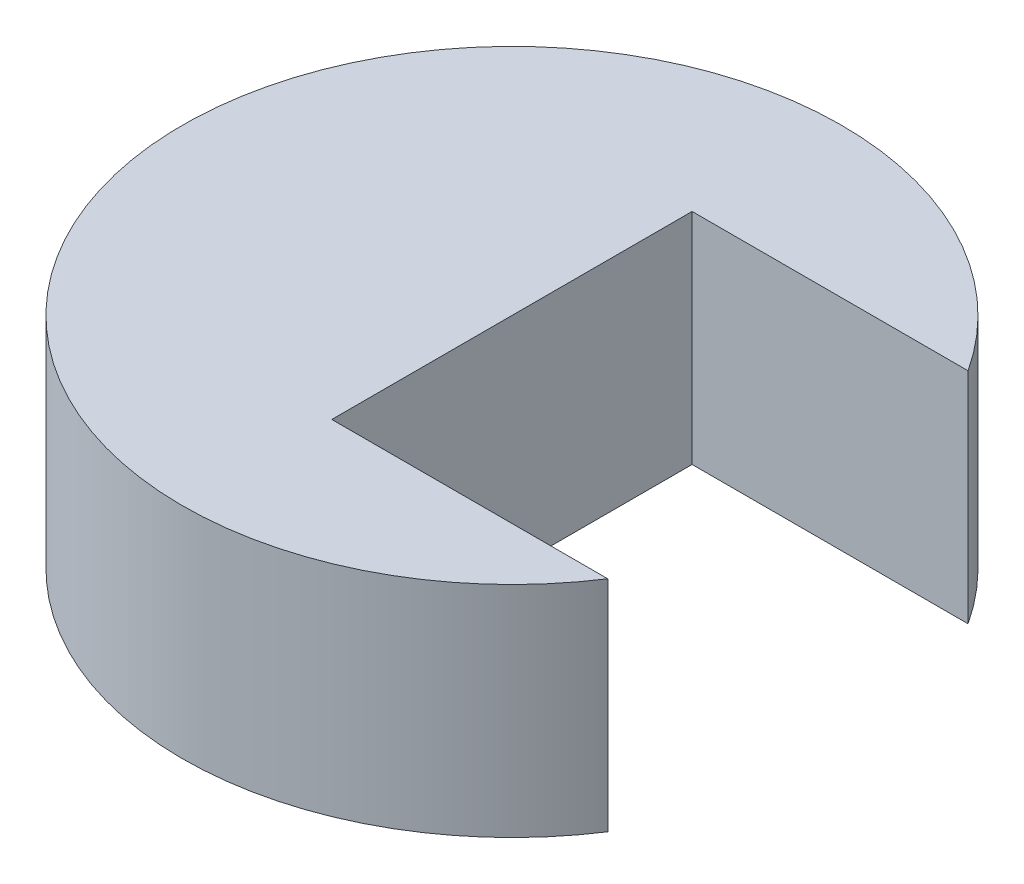
from build123d import *

# Parameters (mm, degrees)
BOSS_EXTRUDE1_DEPTH = 20


with BuildPart() as part:
    # Sketch1 → Boss-Extrude1 (new body)
    with BuildSketch(Plane(origin=(0, 0, 0), x_dir=(1, 0, 0), z_dir=(0, 1, 0))):
        with BuildLine():
            Line((4.130773819, 0), (-21.05231141, 0))
            Line((-21.05231141, 0), (-21.05231141, 32.88170544))
            Line((-21.05231141, 32.88170544), (4.130773819, 32.88170544))
            ThreePointArc((4.130773819, 32.88170544), (-51.127041995, 16.44085272), (4.130773819, 0))
        make_face()
    extrude(amount=BOSS_EXTRUDE1_DEPTH)


solid = part.part
